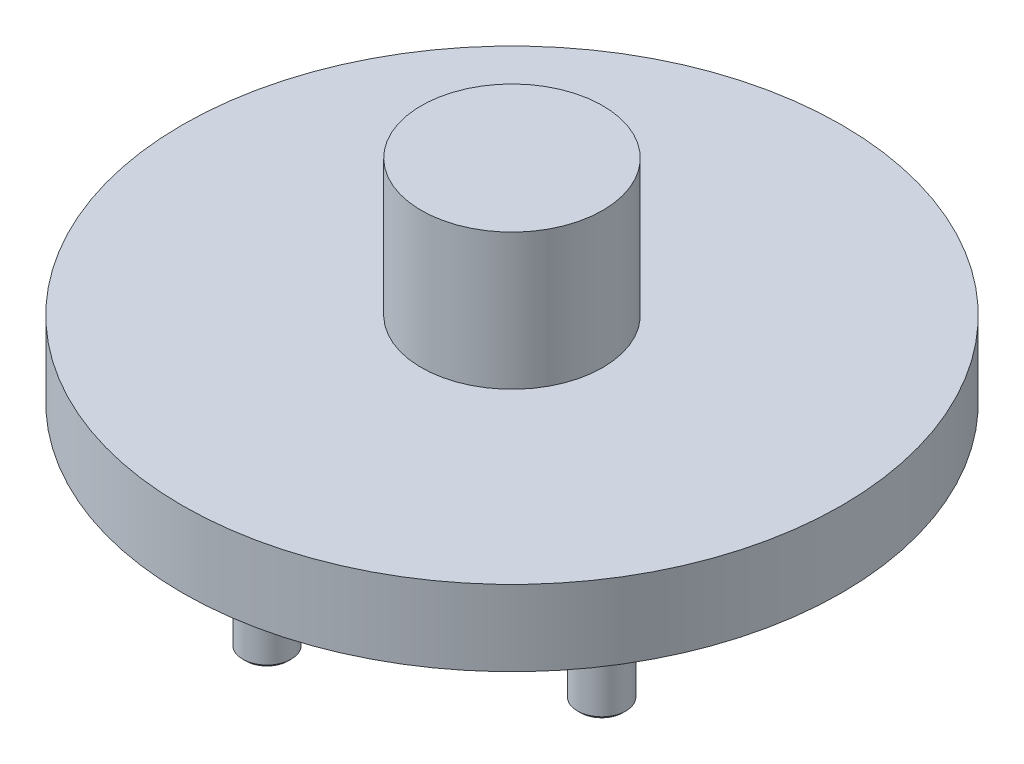
from build123d import *

# Parameters (mm, degrees)
SKETCH2_R                    = 8
BOSS_EXTRUDE1_DEPTH          = 30
CHAMFER1_SIZE                = 1
CIRPATTERN3_COUNT            = 6
CHAMFER1_OF_CIRPATTERN3_SIZE = 1


with BuildPart() as part:
    # Sketch1 → Revolve1 (revolve)
    with BuildSketch(Plane.XY):
        Polygon((0, 0), (53, 0), (53, 5), (109, 5), (109, 30), (30, 30), (30, 75), (0, 75), align=None)
    revolve(axis=Axis((0, 0, 0), (0, 1, 0)))

    # Sketch2 → Boss-Extrude1 (add)
    with BuildSketch(Plane.XZ.offset(-5)):
        with Locations((0, 81)):
            Circle(SKETCH2_R)
    boss_extrude1 = extrude(amount=BOSS_EXTRUDE1_DEPTH)

    # Chamfer1
    chamfer1_edges = [part.edges().sort_by_distance(p)[0] for p in [
        (-8, -25, 81),
    ]]
    chamfer(chamfer1_edges, length=CHAMFER1_SIZE)

    # CirPattern3: Boss-Extrude1 ×6 about axis
    cirpattern3_axis = Axis((0, 0, 0), (0, 1, 0))
    for i in range(1, CIRPATTERN3_COUNT):
        add(boss_extrude1.rotate(cirpattern3_axis, i * 360 / CIRPATTERN3_COUNT))

    # Chamfer1 of CirPattern3
    chamfer1_of_cirpattern3_edges = [part.edges().sort_by_distance(p)[0] for p in [
        (66.148057707, -25, 47.42820323),
        (74.148057707, -25, -33.57179677),
        (8, -25, -81),
        (-66.148057707, -25, -47.42820323),
        (-74.148057707, -25, 33.57179677),
    ]]
    chamfer(chamfer1_of_cirpattern3_edges, length=CHAMFER1_OF_CIRPATTERN3_SIZE)


solid = part.part
